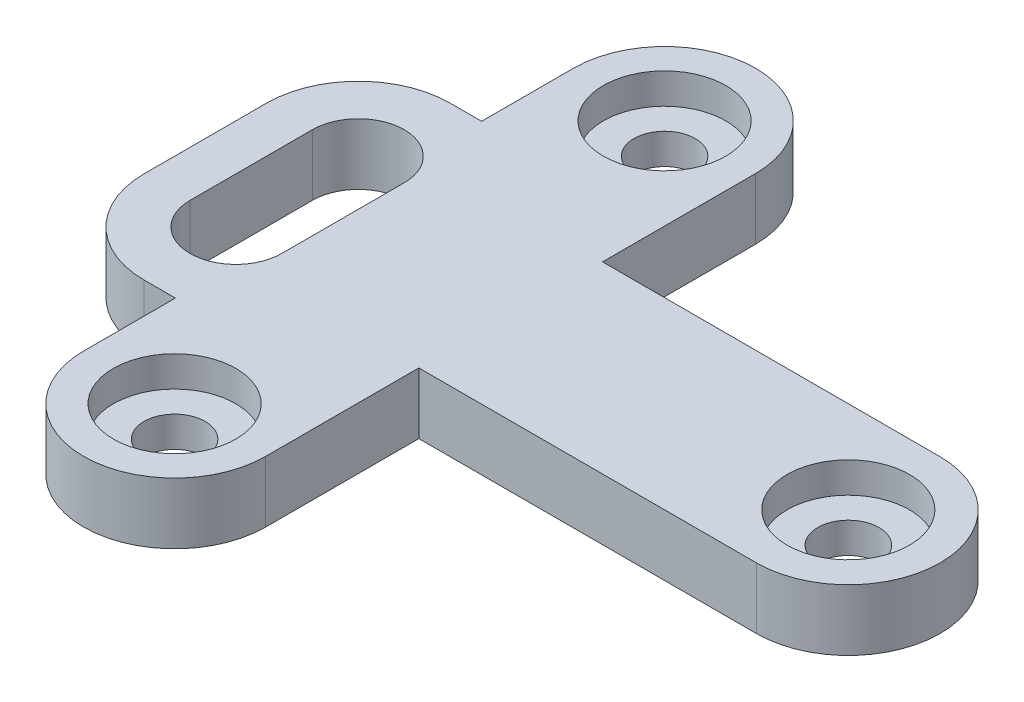
from build123d import *

# Parameters (mm, degrees)
SKETCH3_R           = 10
BOSS_EXTRUDE1_DEPTH = 10
SKETCH3_5_R         = 10
SKETCH3_5_R_2       = 5
BOSS_EXTRUDE3_DEPTH = 5


with BuildPart() as part:
    # Sketch3 → Boss-Extrude1 (new body)
    with BuildSketch(Plane(origin=(0, 0, 0), x_dir=(1, 0, 0), z_dir=(0, 1, 0))):
        with BuildLine():
            ThreePointArc((58.151203912, -15), (73.151203912, 0), (58.151203912, 15))
            Line((58.151203912, 15), (3.026401107, 15))
            Line((3.026401107, 15), (3.026401107, 40))
            ThreePointArc((3.026401107, 40), (-11.848796088, 54.875197195), (-26.723993282, 40))
            Line((-26.723993282, 40), (-26.723993282, 25))
            Line((-26.723993282, 25), (-31.848796088, 25))
            ThreePointArc((-31.848796088, 25), (-42.455397805, 20.606601718), (-46.848796088, 10))
            Line((-46.848796088, 10), (-46.848796088, -10))
            ThreePointArc((-46.848796088, -10), (-42.455397805, -20.606601718), (-31.848796088, -25))
            Line((-31.848796088, -25), (-26.723993282, -25))
            Line((-26.723993282, -25), (-26.723993282, -40))
            ThreePointArc((-26.723993282, -40), (-11.848796088, -54.875197195), (3.026401107, -40))
            Line((3.026401107, -40), (3.026401107, -15))
            Line((3.026401107, -15), (58.151203912, -15))
        make_face()
        with Locations((-11.848796088, -40)):
            Circle(SKETCH3_R, mode=Mode.SUBTRACT)
        with BuildLine():
            Line((-39.348796088, -10), (-39.348796088, 10))
            ThreePointArc((-39.348796088, 10), (-31.848796088, 17.5), (-24.348796088, 10))
            Line((-24.348796088, 10), (-24.348796088, -10))
            ThreePointArc((-24.348796088, -10), (-31.848796088, -17.5), (-39.348796088, -10))
        make_face(mode=Mode.SUBTRACT)
        with Locations((-11.848796088, 40)):
            Circle(SKETCH3_R, mode=Mode.SUBTRACT)
        with Locations((58.151203912, 0)):
            Circle(SKETCH3_R, mode=Mode.SUBTRACT)
    extrude(amount=BOSS_EXTRUDE1_DEPTH)

    # Sketch3<5> → Boss-Extrude3 (add)
    # profile 1 of 3: a face of its own
    with BuildSketch(Plane(origin=(0, 0, 0), x_dir=(1, 0, 0), z_dir=(0, 1, 0))):
        with Locations((58.151203912, 0)):
            Circle(SKETCH3_5_R)
        with Locations((58.151203912, 0)):
            Circle(SKETCH3_5_R_2, mode=Mode.SUBTRACT)
    # profile 2 of 3: a face of its own
    with BuildSketch(Plane(origin=(0, 0, 0), x_dir=(1, 0, 0), z_dir=(0, 1, 0))):
        with Locations((-11.848796088, 40)):
            Circle(SKETCH3_5_R)
        with Locations((-11.848796088, 40)):
            Circle(SKETCH3_5_R_2, mode=Mode.SUBTRACT)
    # profile 3 of 3: a face of its own
    with BuildSketch(Plane(origin=(0, 0, 0), x_dir=(1, 0, 0), z_dir=(0, 1, 0))):
        with Locations((-11.848796088, -40)):
            Circle(SKETCH3_5_R)
        with Locations((-11.848796088, -40)):
            Circle(SKETCH3_5_R_2, mode=Mode.SUBTRACT)
    extrude(amount=BOSS_EXTRUDE3_DEPTH)


solid = part.part
